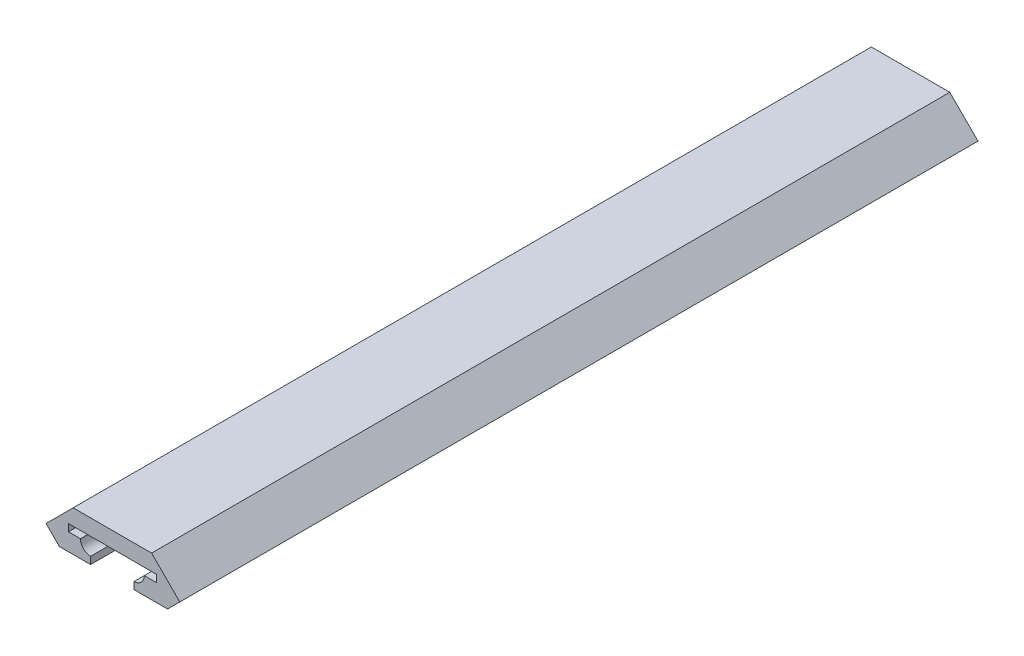
from build123d import *

# Parameters (mm, degrees)
BOSS_EXTRUDE1_DEPTH = 100


with BuildPart() as part:
    # Sketch1 → Boss-Extrude1 (new body)
    with BuildSketch(Plane.XY):
        with BuildLine():
            Line((0, 0), (11, 0))
            Line((11, 0), (11, -0.9))
            Line((11, -0.9), (9.5, -0.9))
            ThreePointArc((9.5, -0.9), (9.128025612, -1.798025612), (8.23, -2.17))
            Line((8.23, -2.17), (8.23, -3.07))
            Line((8.23, -3.07), (12.415281374, -3.07))
            Line((12.415281374, -3.07), (13.949747468, -1.535533906))
            Line((13.949747468, -1.535533906), (10.414213562, 2))
            Line((10.414213562, 2), (0.585786438, 2))
            Line((0.585786438, 2), (-2.814747468, -1.400533906))
            Line((-2.814747468, -1.400533906), (-1.145281374, -3.07))
            Line((-1.145281374, -3.07), (2.77, -3.07))
            Line((2.77, -3.07), (2.77, -2.17))
            ThreePointArc((2.77, -2.17), (1.871974388, -1.798025612), (1.5, -0.9))
            Line((1.5, -0.9), (0, -0.9))
            Line((0, -0.9), (0, 0))
        make_face()
    extrude(amount=BOSS_EXTRUDE1_DEPTH)


solid = part.part
